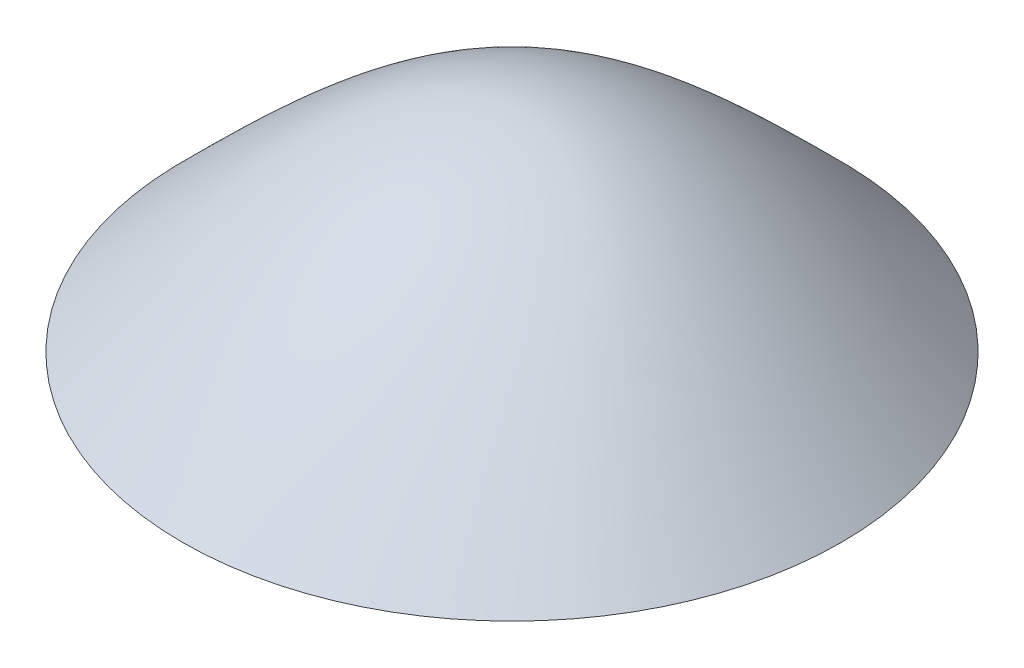
from build123d import *


with BuildPart() as part:
    # 草图1 → 旋转1 (revolve)
    with BuildSketch(Plane.XY, mode=Mode.PRIVATE) as revolve_1_sk:
        with BuildLine():
            Line((0, 1), (0, 0))
            Line((0, 0), (1.56, 0.010796117))
            add(Edge.make_bspline(
                [(0, 1), (0.006667111, 0.999961497), (0.020003998, 0.999884476), (0.04000798, 0.999261626), (0.06001193, 0.998267678), (0.080015833, 0.996866568), (0.100019674, 0.995068646), (0.120023438, 0.992872011), (0.140027112, 0.990278251), (0.160030683, 0.987288225), (0.180034139, 0.983903187), (0.200037469, 0.980124487), (0.220040663, 0.975953649), (0.240043714, 0.971392353), (0.260046613, 0.966442433), (0.280049355, 0.96110588), (0.300051935, 0.955384841), (0.320054348, 0.949281613), (0.340056592, 0.942798652), (0.360058664, 0.935938558), (0.380060565, 0.928704089), (0.400062294, 0.921098145), (0.420063852, 0.91312378), (0.440065242, 0.904784194), (0.460066465, 0.896082731), (0.480067524, 0.887022876), (0.500068423, 0.877608264), (0.520069166, 0.867842667), (0.540069758, 0.857729995), (0.560070203, 0.847274302), (0.580070506, 0.836479773), (0.600070672, 0.82535073), (0.620070707, 0.813891629), (0.640070616, 0.802107056), (0.660070404, 0.790001727), (0.680070078, 0.777580489), (0.70006964, 0.764848308), (0.720069099, 0.751810281), (0.740068459, 0.738471624), (0.760067724, 0.724837671), (0.780066901, 0.710913876), (0.800065993, 0.696705809), (0.820065005, 0.682219154), (0.840063943, 0.667459702), (0.86006281, 0.652433357), (0.880061611, 0.637146129), (0.900060349, 0.621604129), (0.920059029, 0.605813575), (0.940057653, 0.589780779), (0.960056226, 0.573512154), (0.980054751, 0.557014205), (1.000053232, 0.540293527), (1.02005167, 0.523356808), (1.040050069, 0.506210819), (1.060048431, 0.488862418), (1.08004676, 0.47131854), (1.100045057, 0.4535862), (1.120043325, 0.43567249), (1.140041565, 0.417584571), (1.16003978, 0.399329676), (1.180037973, 0.380915104), (1.200036143, 0.36234822), (1.220034294, 0.343636446), (1.240032426, 0.324787264), (1.260030542, 0.305808213), (1.280028643, 0.28670688), (1.300026729, 0.267490904), (1.320024803, 0.248167967), (1.340022865, 0.228745796), (1.360020917, 0.209232159), (1.380018959, 0.189634856), (1.400016994, 0.169961726), (1.42001502, 0.150220633), (1.440013041, 0.130419473), (1.460011057, 0.110566162), (1.480009064, 0.090668637), (1.50000708, 0.070734868), (1.520005051, 0.050772773), (1.540003175, 0.03079053), (1.553333708, 0.017461605), (1.56, 0.010796117)],
                knots=[0, 0, 0, 0, 0.010555616, 0.021115451, 0.031683713, 0.042264587, 0.052862221, 0.063480718, 0.074124122, 0.084796413, 0.095501488, 0.106243158, 0.117025139, 0.127851037, 0.138724349, 0.149648449, 0.160626583, 0.171661864, 0.182757267, 0.193915622, 0.205139614, 0.216431775, 0.227794484, 0.239229963, 0.250740279, 0.262327339, 0.273992891, 0.285738523, 0.297565665, 0.309475588, 0.321469406, 0.333548077, 0.345712403, 0.357963037, 0.370300479, 0.38272508, 0.39523705, 0.407836453, 0.420523214, 0.43329712, 0.446157828, 0.45910486, 0.472137613, 0.485255361, 0.498457255, 0.51174233, 0.525109508, 0.538557599, 0.552085307, 0.565691232, 0.579373875, 0.593131638, 0.606962833, 0.620865679, 0.634838312, 0.648878781, 0.66298506, 0.677155042, 0.691386551, 0.705677338, 0.72002509, 0.734427431, 0.748881922, 0.763386071, 0.77793733, 0.792533102, 0.807170742, 0.821847562, 0.836560831, 0.851307783, 0.866085614, 0.880891491, 0.895722551, 0.910575905, 0.925448644, 0.940337835, 0.955240531, 0.970153774, 0.985074589, 1, 1, 1, 1], degree=3))
        make_face()
    revolve(revolve_1_sk.sketch.rotate(Axis((0, 1, 0), (0, -1, 0)), 90), axis=Axis((0, 1, 0), (0, -1, 0)))

    # 草图2 → 切除-旋转1 (revolve, cut)
    with BuildSketch(Plane(origin=(0, 0, 0), x_dir=(1, 0, 0), z_dir=(0, 1, 0))):
        with BuildLine():
            Line((0, -0.409708786), (0, 0.409708786))
            ThreePointArc((0, 0.409708786), (0.409708786, 0), (0, -0.409708786))
        make_face()
    revolve(axis=Axis((0, 0, 0.409708786), (0, 0, -1)), mode=Mode.SUBTRACT)


solid = part.part
